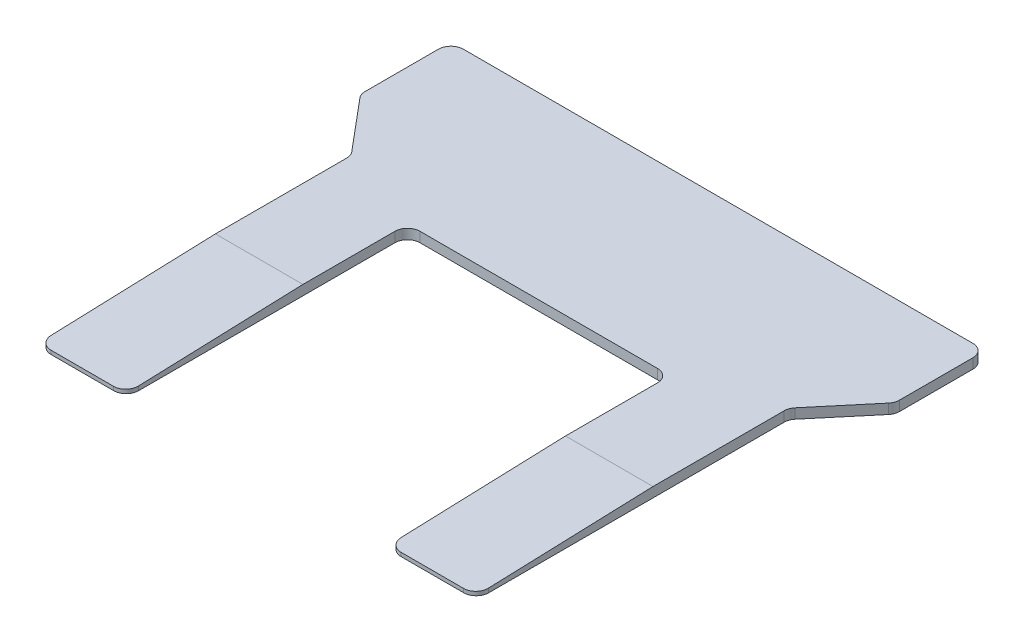
from build123d import *

# Parameters (mm, degrees)
BOSS_EXTRUDE1_DEPTH = 1.5875
CUT_EXTRUDE2_DEPTH  = 109.601439476


with BuildPart() as part:
    # Sketch1 → Boss-Extrude1 (new body)
    with BuildSketch(Plane(origin=(0, 0, 0), x_dir=(1, 0, 0), z_dir=(0, 1, 0))):
        with BuildLine():
            Line((-35, -24.427940469), (-35, -71.7))
            ThreePointArc((-35, -71.7), (-34.414213562, -73.114213562), (-33, -73.7))
            Line((-33, -73.7), (-23, -73.7))
            ThreePointArc((-23, -73.7), (-21.585786438, -73.114213562), (-21, -71.7))
            Line((-21, -71.7), (-21, -30.7))
            ThreePointArc((-21, -30.7), (-20.414213562, -29.285786438), (-19, -28.7))
            Line((-19, -28.7), (19, -28.7))
            ThreePointArc((19, -28.7), (20.414213562, -29.285786438), (21, -30.7))
            Line((21, -30.7), (21, -71.7))
            ThreePointArc((21, -71.7), (21.585786438, -73.114213562), (23, -73.7))
            Line((23, -73.7), (33, -73.7))
            ThreePointArc((33, -73.7), (34.414213562, -73.114213562), (35, -71.7))
            Line((35, -71.7), (35, -24.427940469))
            ThreePointArc((35, -24.427940469), (35.120614758, -23.743900182), (35.467911114, -23.142365249))
            Line((35.467911114, -23.142365249), (42.282088886, -15.021544408))
            ThreePointArc((42.282088886, -15.021544408), (42.629385242, -14.420009476), (42.75, -13.735969189))
            Line((42.75, -13.735969189), (42.75, -2))
            ThreePointArc((42.75, -2), (42.164213562, -0.585786438), (40.75, 0))
            Line((40.75, 0), (-40.75, 0))
            ThreePointArc((-40.75, 0), (-42.164213562, -0.585786438), (-42.75, -2))
            Line((-42.75, -2), (-42.75, -13.735969189))
            ThreePointArc((-42.75, -13.735969189), (-42.629385242, -14.420009476), (-42.282088886, -15.021544408))
            Line((-42.282088886, -15.021544408), (-35.467911114, -23.142365249))
            ThreePointArc((-35.467911114, -23.142365249), (-35.120614758, -23.743900182), (-35, -24.427940469))
        make_face()
    extrude(amount=BOSS_EXTRUDE1_DEPTH)

    # Sketch3 → Cut-Extrude2 (cut, through all)
    with BuildSketch(Plane(origin=(37, 0, 0), x_dir=(0, 0, -1), z_dir=(1, 0, 0))):
        Polygon((-71.7, 1.5875), (-45.421699883, 1.5875), (-73.7, 0.6), (-73.7, 1.5875), align=None)
    extrude(amount=-CUT_EXTRUDE2_DEPTH, mode=Mode.SUBTRACT)


solid = part.part
